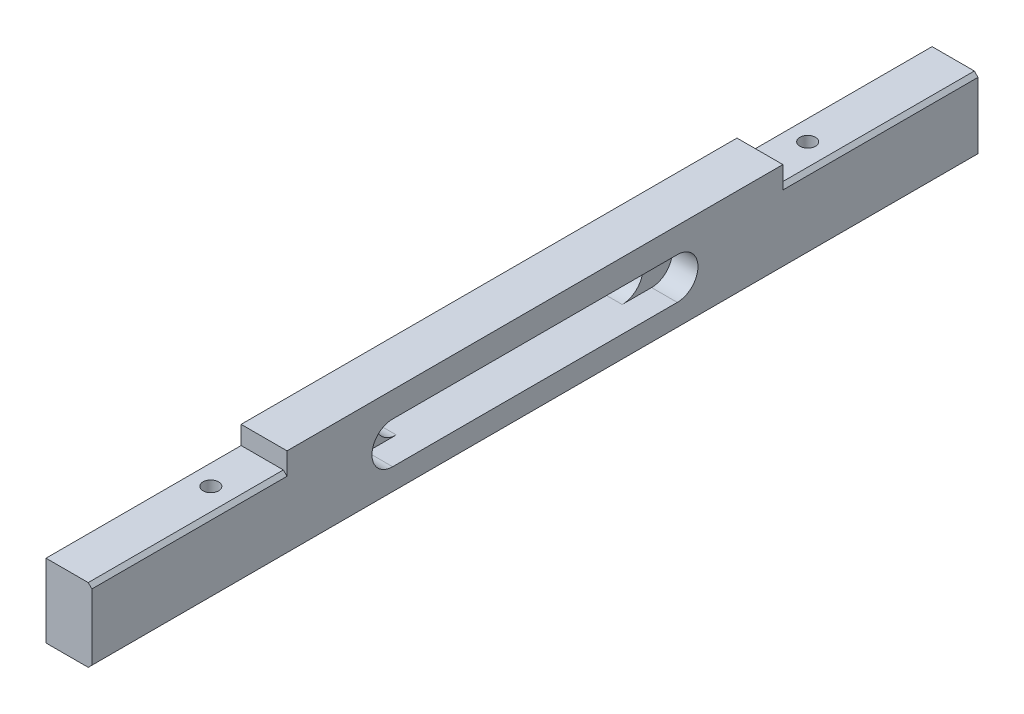
from build123d import *

# Parameters (mm, degrees)
EXTRUDE_1_DEPTH     = 5
CUT_EXTRUDE_1_DEPTH = 2.8
CUT_EXTRUDE_2_DEPTH = 49.765382189
SKETCH_6_W          = 5
SKETCH_6_H          = 21.25
EXTRUDE_2_DEPTH     = 2
SKETCH_5_R          = 0.85
CUT_EXTRUDE_4_DEPTH = 50.528400943
CHAMFER_1_SIZE      = 0.4


with BuildPart() as part:
    # 草图1 → 凸台-拉伸1 (new body)
    with BuildSketch(Plane(origin=(0, 0, 0), x_dir=(0, 0, -1), z_dir=(1, 0, 0))):
        Polygon((-27, 5), (27, 5), (27, 3), (48.25, 3), (48.25, -3), (27, -3), (27, -5), (-27, -5), (-27, -3), (-48.25, -3), (-48.25, 3), (-27, 3), align=None)
    extrude(amount=-EXTRUDE_1_DEPTH)

    # 草图1<3> → 切除-拉伸1 (cut)
    with BuildSketch(Plane(origin=(0, 0, 0), x_dir=(0, 0, -1), z_dir=(1, 0, 0))):
        with BuildLine():
            Line((-15.5, 2.25), (15.5, 2.25))
            ThreePointArc((15.5, 2.25), (17.75, 0), (15.5, -2.25))
            Line((15.5, -2.25), (-15.5, -2.25))
            ThreePointArc((-15.5, -2.25), (-17.75, 0), (-15.5, 2.25))
        make_face()
    extrude(amount=-CUT_EXTRUDE_1_DEPTH, mode=Mode.SUBTRACT)

    # 草图1<4> → 切除-拉伸2 (cut, through all)
    with BuildSketch(Plane(origin=(0, 0, 0), x_dir=(0, 0, -1), z_dir=(1, 0, 0))):
        with BuildLine():
            Line((-12.3, 2.25), (12.3, 2.25))
            ThreePointArc((12.3, 2.25), (14.55, 0), (12.3, -2.25))
            Line((12.3, -2.25), (-12.3, -2.25))
            ThreePointArc((-12.3, -2.25), (-14.55, 0), (-12.3, 2.25))
        make_face()
    extrude(amount=-CUT_EXTRUDE_2_DEPTH, mode=Mode.SUBTRACT)

    # 草图6 → 凸台-拉伸2 (add)
    with BuildSketch(Plane.XZ.offset(3)):
        with Locations((-2.5, -37.625)):
            Rectangle(SKETCH_6_W, SKETCH_6_H)
        with Locations((-2.5, 37.625)):
            Rectangle(SKETCH_6_W, SKETCH_6_H)
    extrude(amount=EXTRUDE_2_DEPTH)

    # 草图5 → 切除-拉伸4 (cut, through all)
    with BuildSketch(Plane.XZ.offset(5)):
        with Locations(Location((-2.8, 32.5, 0), (0, 0, 270))):
            Circle(SKETCH_5_R)
        with Locations(Location((-2.8, -32.5, 0), (0, 0, 270))):
            Circle(SKETCH_5_R)
    extrude(amount=-CUT_EXTRUDE_4_DEPTH, mode=Mode.SUBTRACT)

    # 倒角1
    chamfer_1_edges = [part.edges().sort_by_distance(p)[0] for p in [
        (0, 3, 37.625),
        (0, -5, 0),
        (0, 3, -37.625),
    ]]
    chamfer(chamfer_1_edges, length=CHAMFER_1_SIZE)


solid = part.part
